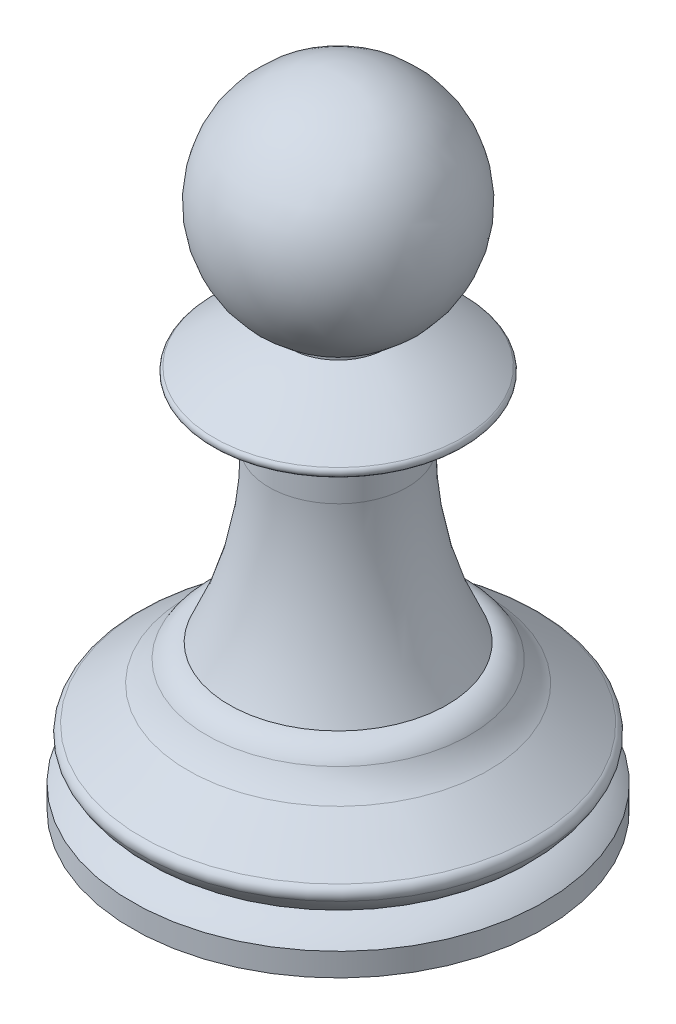
from build123d import *


with BuildPart() as part:
    # Sketch2 → Revolve1 (revolve)
    with BuildSketch(Plane.XY, mode=Mode.PRIVATE) as revolve1_sk:
        with BuildLine():
            Line((0, 0), (-11.96988083, 0))
            Line((-11.96988083, 0), (-11.96988083, 1.340283376))
            ThreePointArc((-11.96988083, 1.340283376), (-11.2331295, 1.901248909), (-10.404461542, 2.314521541))
            ThreePointArc((-10.404461542, 2.314521541), (-11.106179845, 2.880731417), (-11.63207258, 3.613151399))
            ThreePointArc((-11.63207258, 3.613151399), (-11.670741013, 4.017061246), (-11.412476332, 4.330011348))
            Line((-11.412476332, 4.330011348), (-8.737098944, 6.352490289))
            ThreePointArc((-8.737098944, 6.352490289), (-8.132098156, 6.91410221), (-7.651964701, 7.585597383))
            ThreePointArc((-7.651964701, 7.585597383), (-7.094925104, 8.174757479), (-6.330073896, 8.443839921))
            ThreePointArc((-6.330073896, 8.443839921), (-4.606295289, 13.210063627), (-4.021311984, 18.244554231))
            Line((-4.021311984, 18.244554231), (-4.021311984, 21.208163842))
            ThreePointArc((-4.021311984, 21.208163842), (-5.580309883, 21.442384278), (-7.115742629, 21.799847488))
            ThreePointArc((-7.115742629, 21.799847488), (-7.325805309, 22.03138024), (-7.205776672, 22.320044181))
            ThreePointArc((-7.205776672, 22.320044181), (-5.06963874, 23.609952102), (-2.778232272, 24.598083726))
            Line((-2.778232272, 24.598083726), (-2.778232272, 24.845430157))
            ThreePointArc((-2.778232272, 24.845430157), (-6.247093969, 32.04409144), (0, 37.026815862))
            Line((0, 37.026815862), (0, 0))
        make_face()
    revolve(revolve1_sk.sketch.rotate(Axis((0, 0, 0), (0, 1, 0)), 270), axis=Axis((0, 0, 0), (0, 1, 0)))


solid = part.part
